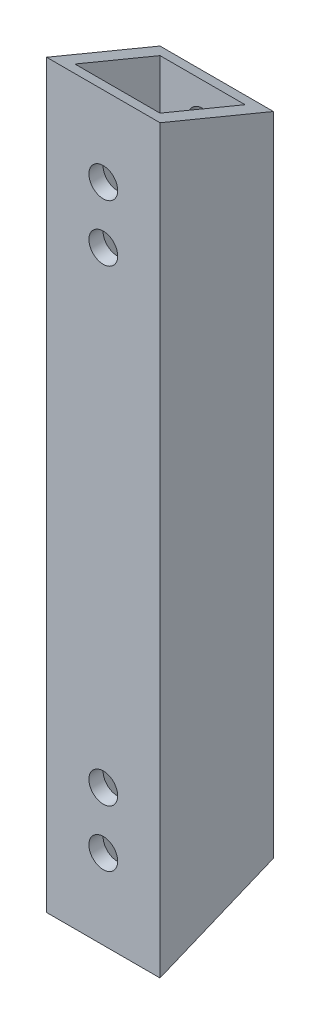
from build123d import *

# Parameters (mm, degrees)
SKETCH1_W           = 25.4
SKETCH1_H           = 25.4
SKETCH1_W_2         = 19.05
SKETCH1_H_2         = 19.05
BOSS_EXTRUDE1_DEPTH = 82.931
CUT_EXTRUDE1_DEPTH  = 88.658432344
SKETCH3_R           = 3.22238806
CUT_EXTRUDE2_DEPTH  = 88.658432344


with BuildPart() as part:
    # Sketch1 → Boss-Extrude1 (new, symmetric)
    with BuildSketch(Plane(origin=(0, 0, 0), x_dir=(1, 0, 0), z_dir=(0, 1, 0))):
        Rectangle(SKETCH1_W, SKETCH1_H)
        Rectangle(SKETCH1_W_2, SKETCH1_H_2, mode=Mode.SUBTRACT)
    extrude(amount=BOSS_EXTRUDE1_DEPTH, both=True)

    # Sketch2 → Cut-Extrude1 (cut, through all)
    with BuildSketch(Plane(origin=(12.7, 0, 0), x_dir=(0, 0, -1), z_dir=(1, 0, 0))):
        Polygon((12.7, 82.931), (-12.7, 82.931), (12.7, 72.409975516), align=None)
        Polygon((12.7, -72.409975516), (-12.7, -82.931), (12.7, -82.931), align=None)
    extrude(amount=-CUT_EXTRUDE1_DEPTH, mode=Mode.SUBTRACT)

    # Sketch3 → Cut-Extrude2 (cut, through all)
    with BuildSketch(Plane(origin=(0, 0, -12.7), x_dir=(-1, 0, 0), z_dir=(0, 0, -1))):
        with Locations((0, -65.043975516)):
            Circle(SKETCH3_R)
        with Locations((0, -52.343975516)):
            Circle(SKETCH3_R)
        with Locations((0, 65.043975516)):
            Circle(SKETCH3_R)
        with Locations((0, 52.343975516)):
            Circle(SKETCH3_R)
    extrude(amount=-CUT_EXTRUDE2_DEPTH, mode=Mode.SUBTRACT)


solid = part.part
